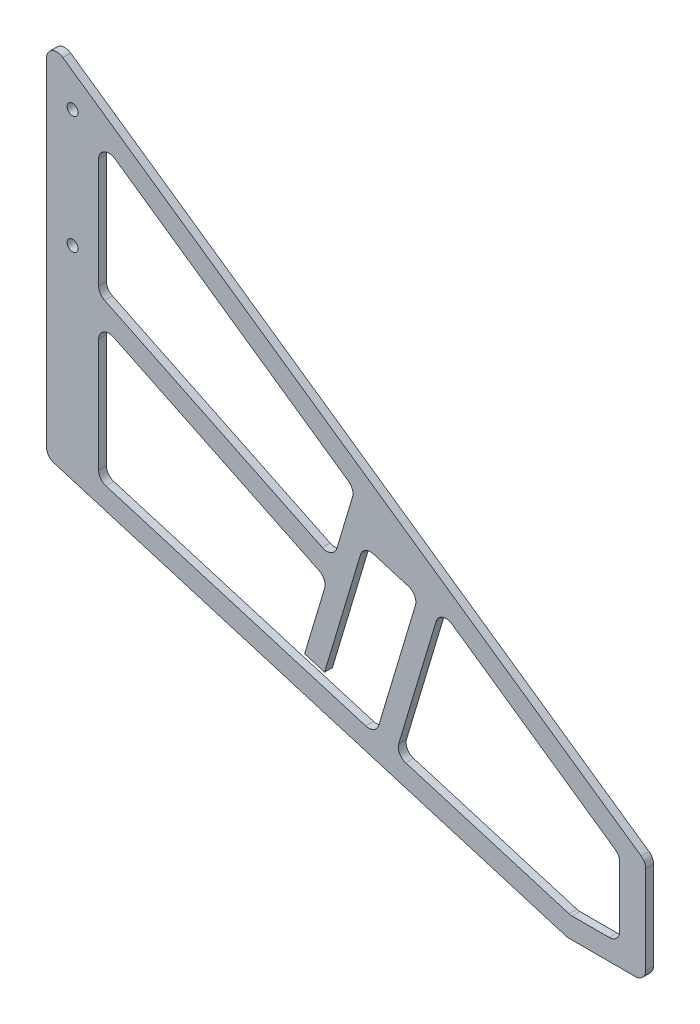
from build123d import *

# Parameters (mm, degrees)
EXTRUDE_1_DEPTH     = 3
SKETCH_2_R          = 2.1
CUT_EXTRUDE_1_DEPTH = 39
CUT_EXTRUDE_2_DEPTH = 10
EXTRUDE_4_DEPTH     = 3
FILLET_1_R          = 4
FILLET_2_R          = 4


with BuildPart() as part:
    # Эскиз1 → Бобышка-Вытянуть1 (new body)
    with BuildSketch(Plane.XY):
        Polygon((0, 0), (0, 140), (230, -20), (230, -60), (200, -60), align=None)
    extrude(amount=EXTRUDE_1_DEPTH)

    # Эскиз2 → Вырез-Вытянуть1 (cut)
    with BuildSketch(Plane.XY.offset(3)):
        with Locations((10, 75)):
            Circle(SKETCH_2_R)
        with Locations((10, 120.2)):
            Circle(SKETCH_2_R)
    extrude(amount=-CUT_EXTRUDE_1_DEPTH, mode=Mode.SUBTRACT)

    # Эскиз5 → Вырез-Вытянуть2 (cut)
    with BuildSketch(Plane.XY.offset(3)):
        Polygon((220, -19.134315533), (220, -55), (200.733844182, -55), (20, -0.779846746), (20, 119.99611925), align=None)
    extrude(amount=-CUT_EXTRUDE_2_DEPTH, mode=Mode.SUBTRACT)

    # Эскиз7 → Бобышка-Вытянуть4 (add)
    with BuildSketch(Plane.XY):
        Polygon((105.308657106, -23.240351925), (126.380835381, -29.562005407), (142.759664858, 25.034092851), (121.687486583, 31.355746333), (106.745396534, -18.451220499), (99.082786252, -16.152437414), (107.752824145, 12.747688898), (20, 55.165339274), (20, 64.05093323), (110.080901053, 20.507945256), (118.313419369, 47.949672977), (20, 116.341616886), (20, 126.086956522), (220.176468292, -13.166238812), (220.176468292, -22.911578447), (151.136541271, 25.116196871), (134.043445663, -31.860788492), (201.17415069, -52), (220, -52), (220, -55), (200.733844182, -55), (20, -0.779846746), (20, 2.352245207), (97.646046824, -20.94156884), align=None)
    extrude(amount=EXTRUDE_4_DEPTH)

    # Скругление1
    fillet_1_edges = [part.edges().sort_by_distance(p)[0] for p in [
        (0, 0, 1.5),
        (0, 140, 1.5),
        (230, -20, 1.5),
        (230, -60, 1.5),
        (200, -60, 1.5),
    ]]
    fillet(fillet_1_edges, radius=FILLET_1_R)

    # Скругление2
    fillet_2_edges = [part.edges().sort_by_distance(p)[0] for p in [
        (220, -22.788817896, 1.5),
        (151.136541271, 25.116196871, 1.5),
        (20, 2.352245207, 1.5),
        (220, -52, 1.5),
        (201.17415069, -52, 1.5),
        (134.043445663, -31.860788492, 1.5),
        (20, 116.341616886, 1.5),
        (118.313419369, 47.949672977, 1.5),
        (110.080901053, 20.507945256, 1.5),
        (20, 64.05093323, 1.5),
        (20, 55.165339274, 1.5),
        (107.752824145, 12.747688898, 1.5),
        (121.687486583, 31.355746333, 1.5),
        (142.759664858, 25.034092851, 1.5),
        (126.380835381, -29.562005407, 1.5),
    ]]
    fillet(fillet_2_edges, radius=FILLET_2_R)


solid = part.part
